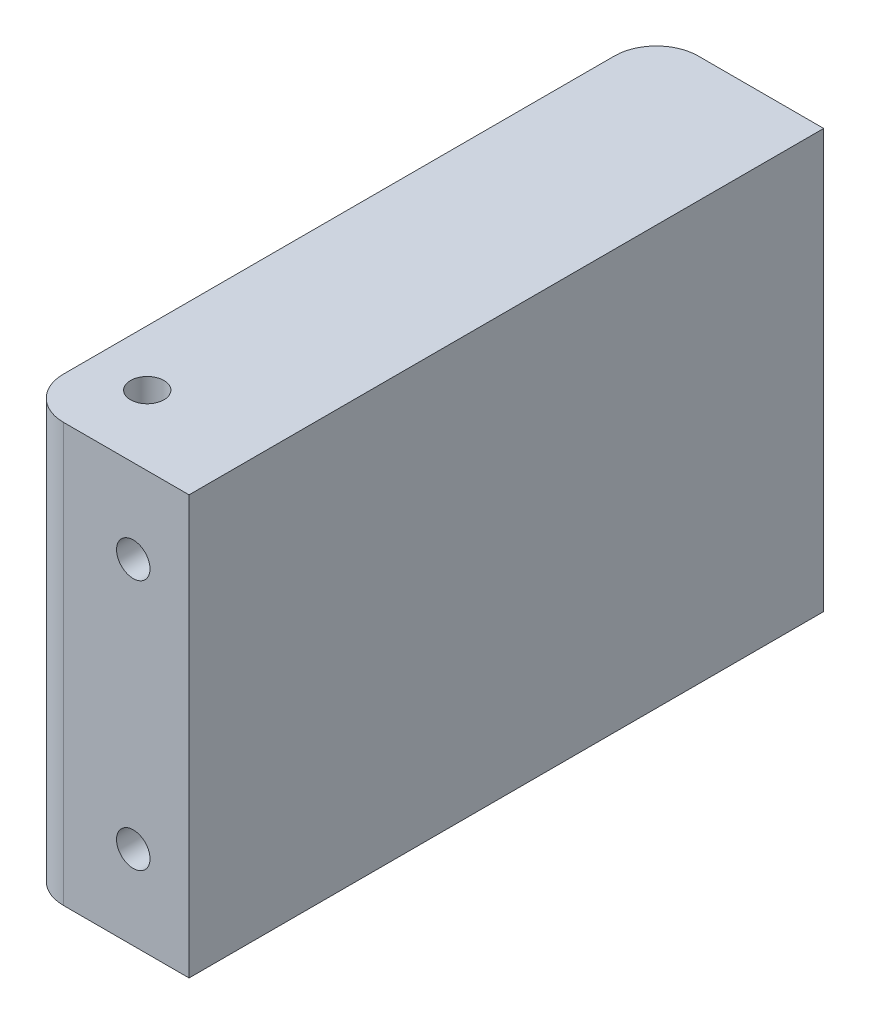
from build123d import *

# Parameters (mm, degrees)
ESQUISSE1_W             = 12
ESQUISSE1_H             = 45.5
ESQUISSE1_R             = 1.2
BOSS_EXTRU_1_DEPTH      = 15
ESQUISSE2_R             = 1.2
ENL_V_MAT_EXTRU_1_DEPTH = 49.28301979
CONG_1_R                = 3


with BuildPart() as part:
    # Esquisse1 → Boss.-Extru.1 (new, symmetric)
    with BuildSketch(Plane(origin=(0, 0, 0), x_dir=(1, 0, 0), z_dir=(0, 1, 0))):
        with Locations((0, 22.75)):
            Rectangle(ESQUISSE1_W, ESQUISSE1_H)
        with Locations(Location((-2, 5, 0), (0, 0, 270))):
            Circle(ESQUISSE1_R, mode=Mode.SUBTRACT)
    extrude(amount=BOSS_EXTRU_1_DEPTH, both=True)

    # Esquisse2 → Enlèv. mat.-Extru.1 (cut, through all)
    with BuildSketch(Plane.XY):
        with Locations((2, 9)):
            Circle(ESQUISSE2_R)
        with Locations(Location((2, -9, 0), (0, 0, 180))):
            Circle(ESQUISSE2_R)
    extrude(amount=-ENL_V_MAT_EXTRU_1_DEPTH, mode=Mode.SUBTRACT)

    # Congé1
    cong_1_edges = [part.edges().sort_by_distance(p)[0] for p in [
        (-6, 0, -45.5),
        (-6, 0, 0),
    ]]
    fillet(cong_1_edges, radius=CONG_1_R)


solid = part.part
